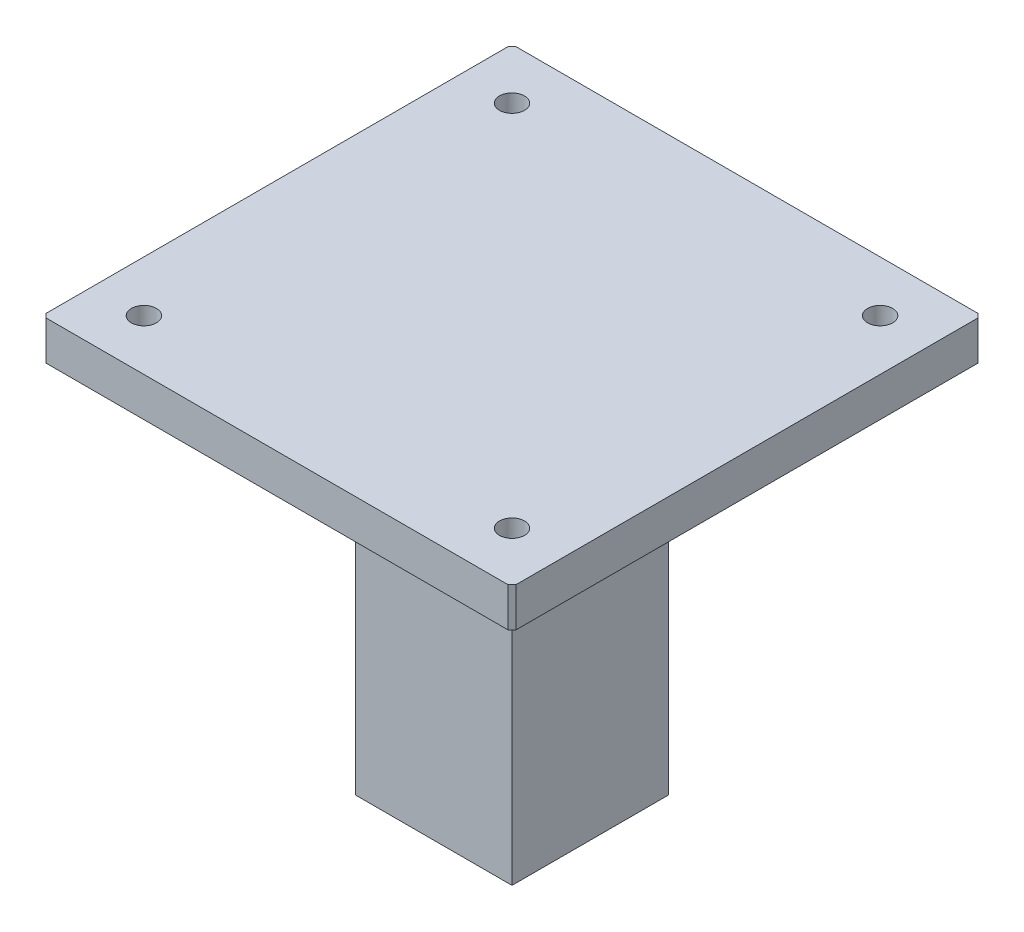
from build123d import *

# Parameters (mm, degrees)
SKIZZE1_W                       = 60
SKIZZE1_H                       = 60
AUFSATZ_LINEAR_AUSTRAGEN1_DEPTH = 5
SKIZZE7_R                       = 1.6
SCHNITT_LINEAR_AUSTRAGEN1_DEPTH = 10
FASE1_SIZE                      = 0.5
SKIZZE8_W                       = 20
SKIZZE8_H                       = 20
AUFSATZ_LINEAR_AUSTRAGEN2_DEPTH = 48


with BuildPart() as part:
    # Skizze1 → Aufsatz-Linear austragen1 (new body)
    with BuildSketch(Plane(origin=(0, 0, 0), x_dir=(1, 0, 0), z_dir=(0, 1, 0))):
        with Locations((25, 30)):
            Rectangle(SKIZZE1_W, SKIZZE1_H)
    extrude(amount=AUFSATZ_LINEAR_AUSTRAGEN1_DEPTH)

    # Skizze7 → Schnitt-Linear austragen1 (cut)
    with BuildSketch(Plane(origin=(0, 5, 0), x_dir=(1, 0, 0), z_dir=(0, 1, 0))):
        with Locations(Location((1.5, 53.5, 0), (0, 0, 270))):
            Circle(SKIZZE7_R)
        with Locations(Location((48.5, 53.5, 0), (0, 0, 270))):
            Circle(SKIZZE7_R)
        with Locations(Location((48.5, 6.5, 0), (0, 0, 270))):
            Circle(SKIZZE7_R)
        with Locations(Location((1.5, 6.5, 0), (0, 0, 270))):
            Circle(SKIZZE7_R)
    extrude(amount=-SCHNITT_LINEAR_AUSTRAGEN1_DEPTH, mode=Mode.SUBTRACT)

    # Fase1
    fase1_edges = [part.edges().sort_by_distance(p)[0] for p in [
        (-5, 2.5, -60),
        (55, 2.5, -60),
        (55, 2.5, 0),
        (-5, 2.5, 0),
    ]]
    chamfer(fase1_edges, length=FASE1_SIZE)

    # Skizze8 → Aufsatz-Linear austragen2 (add)
    with BuildSketch(Plane.XZ):
        with Locations((25, -30)):
            Rectangle(SKIZZE8_W, SKIZZE8_H)
    extrude(amount=AUFSATZ_LINEAR_AUSTRAGEN2_DEPTH)


solid = part.part
